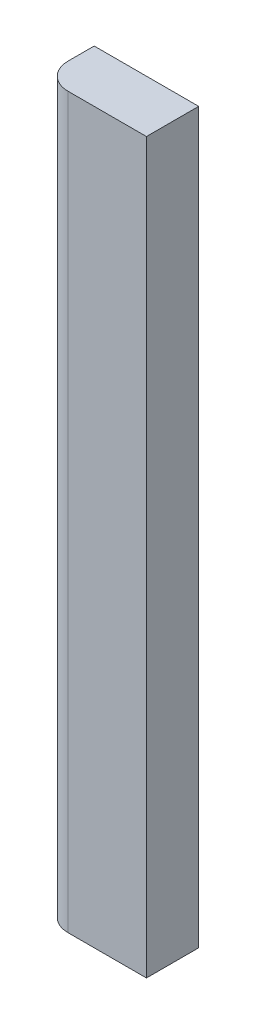
from build123d import *

# Parameters (mm, degrees)
SKETCH1_W           = 101.6
SKETCH1_H           = 708.406
BOSS_EXTRUDE1_DEPTH = 50.8
FILLET1_R           = 25.4


with BuildPart() as part:
    # Sketch1 → Boss-Extrude1 (new body)
    with BuildSketch(Plane.XY):
        with Locations((33.530470144, 320.694956996)):
            Rectangle(SKETCH1_W, SKETCH1_H)
    extrude(amount=BOSS_EXTRUDE1_DEPTH)

    # Fillet1
    fillet1_edges = [part.edges().sort_by_distance(p)[0] for p in [
        (-17.269529856, 320.694956996, 50.8),
    ]]
    fillet(fillet1_edges, radius=FILLET1_R)


solid = part.part
